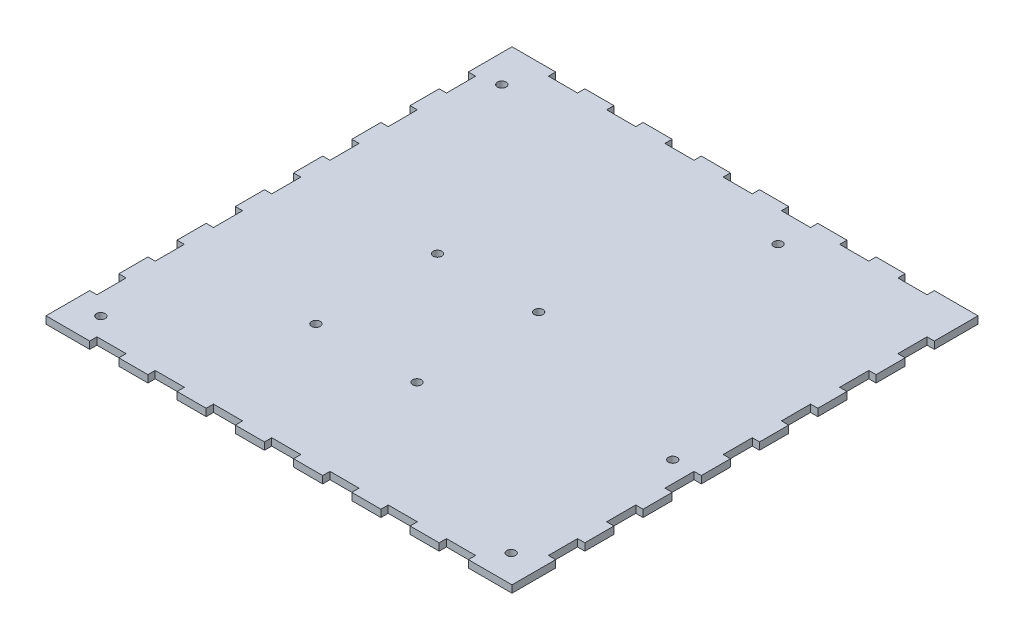
from build123d import *

# Parameters (mm, degrees)
SKETCH1_W           = 160
SKETCH1_H           = 160
BOSS_EXTRUDE1_DEPTH = 1.25
SKETCH3_W           = 2.5
SKETCH3_H           = 10
SKETCH3_W_2         = 10
SKETCH3_H_2         = 2.5
CUT_EXTRUDE2_DEPTH  = 114.164702978
SKETCH2_R           = 1.5
CUT_EXTRUDE1_DEPTH  = 114.164702978


with BuildPart() as part:
    # Sketch1 → Boss-Extrude1 (new, symmetric)
    with BuildSketch(Plane(origin=(0, 0, 0), x_dir=(1, 0, 0), z_dir=(0, 1, 0))):
        Rectangle(SKETCH1_W, SKETCH1_H)
    extrude(amount=BOSS_EXTRUDE1_DEPTH, both=True)

    # Sketch3 → Cut-Extrude2 (cut, through all)
    with BuildSketch(Plane(origin=(0, 1.25, 0), x_dir=(1, 0, 0), z_dir=(0, 1, 0))):
        with Locations((-78.75, 60)):
            Rectangle(SKETCH3_W, SKETCH3_H)
        with Locations((-78.75, 40)):
            Rectangle(SKETCH3_W, SKETCH3_H)
        with Locations((-78.75, 20)):
            Rectangle(SKETCH3_W, SKETCH3_H)
        with Locations((-78.75, 0)):
            Rectangle(SKETCH3_W, SKETCH3_H)
        with Locations((-78.75, -20)):
            Rectangle(SKETCH3_W, SKETCH3_H)
        with Locations((-78.75, -40)):
            Rectangle(SKETCH3_W, SKETCH3_H)
        with Locations((-78.75, -60)):
            Rectangle(SKETCH3_W, SKETCH3_H)
        with Locations((-60, -78.75)):
            Rectangle(SKETCH3_W_2, SKETCH3_H_2)
        with Locations((-40, -78.75)):
            Rectangle(SKETCH3_W_2, SKETCH3_H_2)
        with Locations((-20, -78.75)):
            Rectangle(SKETCH3_W_2, SKETCH3_H_2)
        with Locations((0, -78.75)):
            Rectangle(SKETCH3_W_2, SKETCH3_H_2)
        with Locations((20, -78.75)):
            Rectangle(SKETCH3_W_2, SKETCH3_H_2)
        with Locations((40, -78.75)):
            Rectangle(SKETCH3_W_2, SKETCH3_H_2)
        with Locations((60, -78.75)):
            Rectangle(SKETCH3_W_2, SKETCH3_H_2)
        with Locations((78.75, -60)):
            Rectangle(SKETCH3_W, SKETCH3_H)
        with Locations((78.75, 40)):
            Rectangle(SKETCH3_W, SKETCH3_H)
        with Locations((78.75, 20)):
            Rectangle(SKETCH3_W, SKETCH3_H)
        with Locations((78.75, 0)):
            Rectangle(SKETCH3_W, SKETCH3_H)
        with Locations((78.75, -20)):
            Rectangle(SKETCH3_W, SKETCH3_H)
        with Locations((78.75, -40)):
            Rectangle(SKETCH3_W, SKETCH3_H)
        with Locations((60, 78.75)):
            Rectangle(SKETCH3_W_2, SKETCH3_H_2)
        with Locations((40, 78.75)):
            Rectangle(SKETCH3_W_2, SKETCH3_H_2)
        with Locations((20, 78.75)):
            Rectangle(SKETCH3_W_2, SKETCH3_H_2)
        with Locations((0, 78.75)):
            Rectangle(SKETCH3_W_2, SKETCH3_H_2)
        with Locations((-20, 78.75)):
            Rectangle(SKETCH3_W_2, SKETCH3_H_2)
        with Locations((-40, 78.75)):
            Rectangle(SKETCH3_W_2, SKETCH3_H_2)
        with Locations((-60, 78.75)):
            Rectangle(SKETCH3_W_2, SKETCH3_H_2)
        with Locations((78.75, 60)):
            Rectangle(SKETCH3_W, SKETCH3_H)
    extrude(amount=-CUT_EXTRUDE2_DEPTH, mode=Mode.SUBTRACT)

    # Sketch2 → Cut-Extrude1 (cut, through all)
    with BuildSketch(Plane(origin=(0, 1.25, 0), x_dir=(1, 0, 0), z_dir=(0, 1, 0))):
        with Locations(Location((24.35481, 66.99998, 0), (0, 0, 270))):
            Circle(SKETCH2_R)
        with Locations(Location((-70.50001, 66.99998, 0), (0, 0, 270))):
            Circle(SKETCH2_R)
        with Locations(Location((70.38235, -15.19905, 0), (0, 0, 270))):
            Circle(SKETCH2_R)
        with Locations(Location((-31.25208, 5.67683, 0), (0, 0, 270))):
            Circle(SKETCH2_R)
        with Locations(Location((3.45737, 5.67683, 0), (0, 0, 270))):
            Circle(SKETCH2_R)
        with Locations(Location((3.45737, -36.07493, 0), (0, 0, 270))):
            Circle(SKETCH2_R)
        with Locations(Location((-70.50001, -70.67262, 0), (0, 0, 270))):
            Circle(SKETCH2_R)
        with Locations(Location((-31.25208, -36.07493, 0), (0, 0, 270))):
            Circle(SKETCH2_R)
        with Locations(Location((70.38235, -70.67262, 0), (0, 0, 270))):
            Circle(SKETCH2_R)
    extrude(amount=-CUT_EXTRUDE1_DEPTH, mode=Mode.SUBTRACT)


solid = part.part
